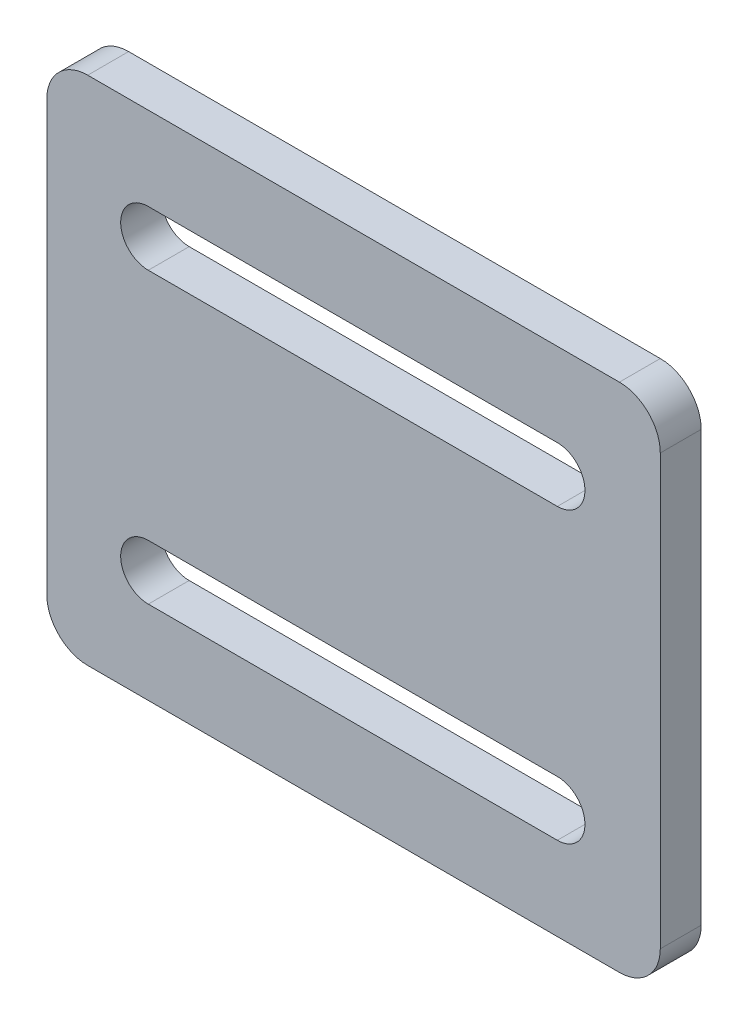
from build123d import *

# Parameters (mm, degrees)
SALIENTE_EXTRUIR1_DEPTH = 2


with BuildPart() as part:
    # Croquis1 → Saliente-Extruir1 (new body)
    with BuildSketch(Plane.XY):
        with BuildLine():
            Line((-26.079318717, 9.413106796), (-26.079318717, 30.413106796))
            ThreePointArc((-26.079318717, 30.413106796), (-26.665105155, 31.827320358), (-28.079318717, 32.413106796))
            Line((-28.079318717, 32.413106796), (-54.079318717, 32.413106796))
            ThreePointArc((-54.079318717, 32.413106796), (-55.49353228, 31.827320358), (-56.079318717, 30.413106796))
            Line((-56.079318717, 30.413106796), (-56.079318717, 9.413106796))
            ThreePointArc((-56.079318717, 9.413106796), (-55.49353228, 7.998893234), (-54.079318717, 7.413106796))
            Line((-54.079318717, 7.413106796), (-28.079318717, 7.413106796))
            ThreePointArc((-28.079318717, 7.413106796), (-26.665105155, 7.998893234), (-26.079318717, 9.413106796))
        make_face()
        with BuildLine():
            Line((-51.116977867, 25.633106796), (-31.11373164, 25.633106796))
            add(Edge.make_bspline(
                [(-31.11373164, 25.633106796), (-29.76351252, 25.633106796), (-29.76351252, 26.983106796), (-29.76351252, 28.333106796), (-31.11373164, 28.333106796)],
                knots=[4.71238898, 4.71238898, 4.71238898, 6.283185307, 6.283185307, 7.853981634, 7.853981634, 7.853981634], degree=2, weights=[1, 0.707106781, 1, 0.707106781, 1]))
            Line((-31.11373164, 28.333106796), (-51.116977867, 28.333106796))
            add(Edge.make_bspline(
                [(-51.116977867, 28.333106796), (-52.467196987, 28.333106796), (-52.467196987, 26.983106796), (-52.467196987, 25.633106796), (-51.116977867, 25.633106796)],
                knots=[4.71238898, 4.71238898, 4.71238898, 6.283185307, 6.283185307, 7.853981634, 7.853981634, 7.853981634], degree=2, weights=[1, 0.707106781, 1, 0.707106781, 1]))
        make_face(mode=Mode.SUBTRACT)
        with BuildLine():
            Line((-51.116977867, 11.493106796), (-31.11373164, 11.493106796))
            add(Edge.make_bspline(
                [(-31.11373164, 11.493106796), (-29.76351252, 11.493106796), (-29.76351252, 12.843106796), (-29.76351252, 14.193106796), (-31.11373164, 14.193106796)],
                knots=[1.570796327, 1.570796327, 1.570796327, 3.141592654, 3.141592654, 4.71238898, 4.71238898, 4.71238898], degree=2, weights=[1, 0.707106781, 1, 0.707106781, 1]))
            Line((-31.11373164, 14.193106796), (-51.116977867, 14.193106796))
            add(Edge.make_bspline(
                [(-51.116977867, 14.193106796), (-52.467196987, 14.193106796), (-52.467196987, 12.843106796), (-52.467196987, 11.493106796), (-51.116977867, 11.493106796)],
                knots=[4.71238898, 4.71238898, 4.71238898, 6.283185307, 6.283185307, 7.853981634, 7.853981634, 7.853981634], degree=2, weights=[1, 0.707106781, 1, 0.707106781, 1]))
        make_face(mode=Mode.SUBTRACT)
    extrude(amount=SALIENTE_EXTRUIR1_DEPTH)


solid = part.part
